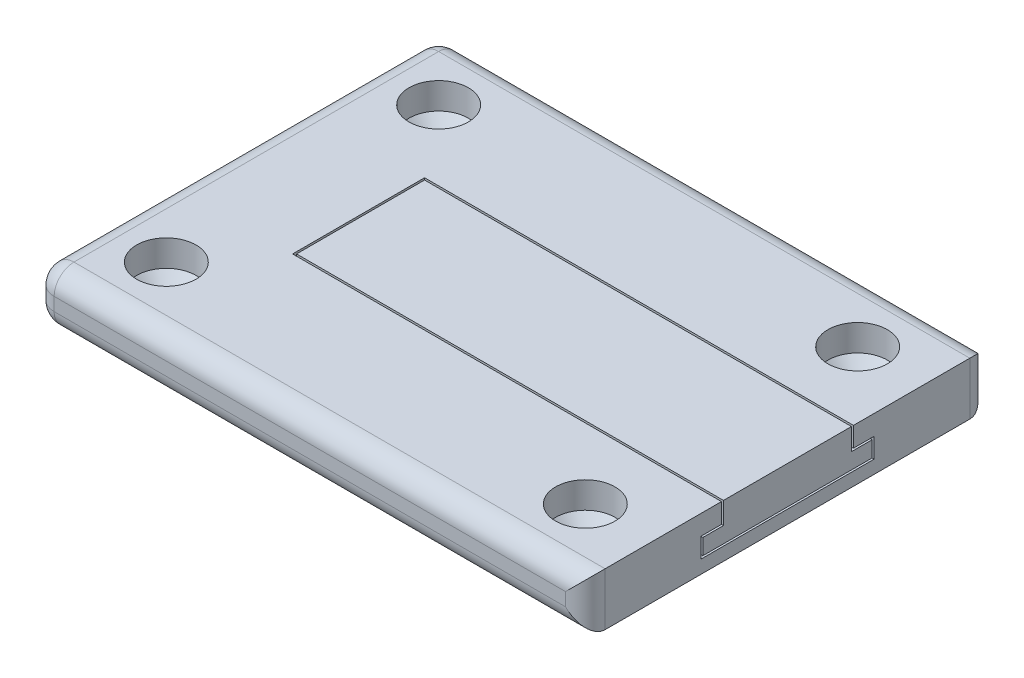
from build123d import *

# Parameters (mm, degrees)
SKETCH1_W           = 83.5
SKETCH1_H           = 61.275
SKETCH1_R           = 2.5
BOSS_EXTRUDE1_DEPTH = 4
CHAMFER1_SIZE       = 2
SKETCH3_W           = 83.5
SKETCH3_H           = 61.275
SKETCH3_R           = 4.5
BOSS_EXTRUDE2_DEPTH = 4
SKETCH4_W           = 26.275
SKETCH4_H           = 3
SKETCH4_W_2         = 20
CUT_EXTRUDE1_DEPTH  = 65
BOSS_EXTRUDE3_DEPTH = 64.7
FILLET1_R           = 3


with BuildPart() as part:
    # Sketch1 → Boss-Extrude1 (new body)
    with BuildSketch(Plane(origin=(0, 0, 0), x_dir=(1, 0, 0), z_dir=(0, 1, 0))):
        Rectangle(SKETCH1_W, SKETCH1_H)
        with Locations(Location((-31.75, 20.6375, 0), (0, 0, 270))):
            Circle(SKETCH1_R, mode=Mode.SUBTRACT)
        with Locations(Location((-31.75, -20.6375, 0), (0, 0, 270))):
            Circle(SKETCH1_R, mode=Mode.SUBTRACT)
        with Locations(Location((31.75, -20.6375, 0), (0, 0, 270))):
            Circle(SKETCH1_R, mode=Mode.SUBTRACT)
        with Locations(Location((31.75, 20.6375, 0), (0, 0, 270))):
            Circle(SKETCH1_R, mode=Mode.SUBTRACT)
    extrude(amount=BOSS_EXTRUDE1_DEPTH)

    # Chamfer1
    chamfer1_edges = [part.edges().sort_by_distance(p)[0] for p in [
        (-31.75, 4, -23.1375),
        (-31.75, 4, 18.1375),
        (31.75, 4, 18.1375),
        (31.75, 4, -23.1375),
    ]]
    chamfer(chamfer1_edges, length=CHAMFER1_SIZE)

    # Sketch3 → Boss-Extrude2 (add)
    with BuildSketch(Plane(origin=(0, 4, 0), x_dir=(1, 0, 0), z_dir=(0, 1, 0))):
        Rectangle(SKETCH3_W, SKETCH3_H)
        with Locations(Location((31.75, 20.6375, 0), (0, 0, 270))):
            Circle(SKETCH3_R, mode=Mode.SUBTRACT)
        with Locations(Location((31.75, -20.6375, 0), (0, 0, 270))):
            Circle(SKETCH3_R, mode=Mode.SUBTRACT)
        with Locations(Location((-31.75, -20.6375, 0), (0, 0, 270))):
            Circle(SKETCH3_R, mode=Mode.SUBTRACT)
        with Locations(Location((-31.75, 20.6375, 0), (0, 0, 270))):
            Circle(SKETCH3_R, mode=Mode.SUBTRACT)
    extrude(amount=BOSS_EXTRUDE2_DEPTH)

    # Sketch4 → Cut-Extrude1 (cut)
    with BuildSketch(Plane(origin=(41.75, 0, 0), x_dir=(0, 0, -1), z_dir=(1, 0, 0))):
        with Locations((0, 3.5)):
            Rectangle(SKETCH4_W, SKETCH4_H)
        with Locations((0, 6.5)):
            Rectangle(SKETCH4_W_2, SKETCH4_H)
    extrude(amount=-CUT_EXTRUDE1_DEPTH, mode=Mode.SUBTRACT)

    # Fillet1
    fillet1_edges = [part.edges().sort_by_distance(p)[0] for p in [
        (0, 8, 30.6375),
        (0, 8, -30.6375),
        (-41.75, 8, 0),
        (0, 0, 30.6375),
        (-41.75, 0, 0),
        (0, 0, -30.6375),
        (41.75, 4, 30.6375),
        (-41.75, 4, 30.6375),
        (-41.75, 4, -30.6375),
        (41.75, 4, -30.6375),
    ]]
    fillet(fillet1_edges, radius=FILLET1_R)


with BuildPart() as body_2:
    # Sketch5 → Boss-Extrude3 (new body)
    with BuildSketch(Plane(origin=(41.75, 0, 0), x_dir=(0, 0, -1), z_dir=(1, 0, 0))):
        Polygon((-9.7, 8), (9.7, 8), (9.7, 4.7), (12.8375, 4.7), (12.8375, 2.3), (-12.8375, 2.3), (-12.8375, 4.7), (-9.7, 4.7), align=None)
    extrude(amount=-BOSS_EXTRUDE3_DEPTH)


solid = Compound([part.part, body_2.part])
